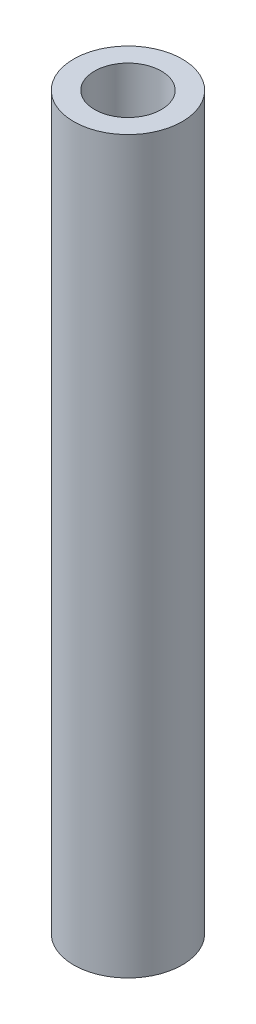
from build123d import *

# Parameters (mm, degrees)
SKETCH1_R           = 2.6
SKETCH1_R_2         = 1.6
BOSS_EXTRUDE1_DEPTH = 35


with BuildPart() as part:
    # Sketch1 → Boss-Extrude1 (new body)
    with BuildSketch(Plane(origin=(0, 3, 0), x_dir=(1, 0, 0), z_dir=(0, 1, 0))):
        with Locations(Location((-20, 25, 0), (0, 0, 270))):
            Circle(SKETCH1_R)
        with Locations(Location((-20, 25, 0), (0, 0, 270))):
            Circle(SKETCH1_R_2, mode=Mode.SUBTRACT)
    extrude(amount=BOSS_EXTRUDE1_DEPTH)


solid = part.part
